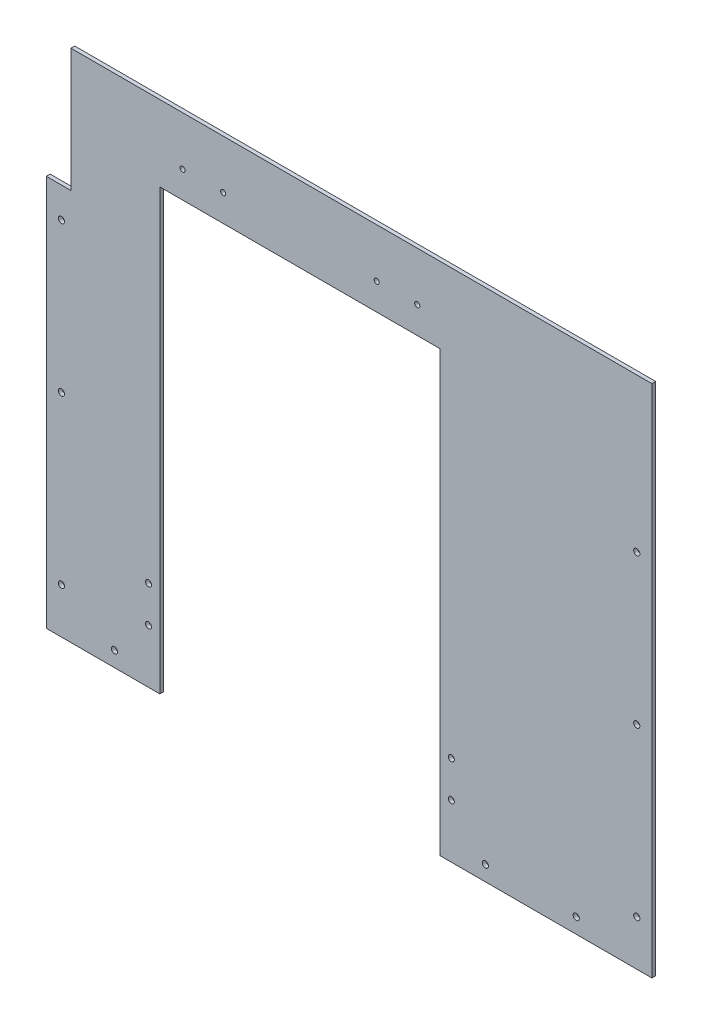
from build123d import *

# Parameters (mm, degrees)
SKETCH1_W           = 508
SKETCH1_H           = 508
BOSS_EXTRUDE1_DEPTH = 3.175
SKETCH2_R           = 2.54
SKETCH2_W           = 234.95
SKETCH2_H           = 368.3
CUT_EXTRUDE1_DEPTH  = 44.45
SKETCH4_R           = 2.159
CUT_EXTRUDE3_DEPTH  = 719.427505476
SKETCH5_R           = 2.6
CUT_EXTRUDE4_DEPTH  = 719.427505476
SKETCH6_W           = 487.3625
SKETCH6_H           = 76.2
CUT_EXTRUDE5_DEPTH  = 719.427505476


with BuildPart() as part:
    # Sketch1 → Boss-Extrude1 (new body)
    with BuildSketch(Plane.XY):
        with Locations((254, 254)):
            Rectangle(SKETCH1_W, SKETCH1_H)
    extrude(amount=BOSS_EXTRUDE1_DEPTH)

    # Sketch2 → Cut-Extrude1 (cut)
    with BuildSketch(Plane(origin=(0, 0, 0), x_dir=(-1, 0, 0), z_dir=(0, 0, -1))):
        with Locations((-339.725, 45.085)):
            Circle(SKETCH2_R)
        with Locations((-85.725, 45.085)):
            Circle(SKETCH2_R)
        with Locations((-339.725, 75.565)):
            Circle(SKETCH2_R)
        with Locations((-85.725, 75.565)):
            Circle(SKETCH2_R)
        with Locations((-212.725, 184.15)):
            Rectangle(SKETCH2_W, SKETCH2_H)
        Polygon((0, 403.06625), (0, 328.45375), (-20.6375, 328.45375), (-20.6375, 403.06625), (-20.6375, 508), (0, 508), align=None)
    extrude(amount=-CUT_EXTRUDE1_DEPTH, mode=Mode.SUBTRACT)

    # Sketch4 → Cut-Extrude3 (cut, through all)
    with BuildSketch(Plane(origin=(0, 0, 0), x_dir=(-1, 0, 0), z_dir=(0, 0, -1))):
        with Locations((-311.1754, 390.779)):
            Circle(SKETCH4_R)
        with Locations((-277.1394, 390.779)):
            Circle(SKETCH4_R)
        with Locations((-148.3614, 390.779)):
            Circle(SKETCH4_R)
        with Locations((-114.3254, 390.779)):
            Circle(SKETCH4_R)
    extrude(amount=-CUT_EXTRUDE3_DEPTH, mode=Mode.SUBTRACT)

    # Sketch5 → Cut-Extrude4 (cut, through all)
    with BuildSketch(Plane.XY.offset(3.175)):
        with Locations((12.7, 303.05375)):
            Circle(SKETCH5_R)
        with Locations((12.7, 177.8)):
            Circle(SKETCH5_R)
        with Locations((12.7, 38.1)):
            Circle(SKETCH5_R)
        with Locations((495.3, 38.1)):
            Circle(SKETCH5_R)
        with Locations((495.3, 177.8)):
            Circle(SKETCH5_R)
        with Locations((495.3, 303.05375)):
            Circle(SKETCH5_R)
        with Locations((495.3, 469.9)):
            Circle(SKETCH5_R)
        with Locations((57.15, 12.7)):
            Circle(SKETCH5_R)
        with Locations((368.3, 12.7)):
            Circle(SKETCH5_R)
        with Locations((444.5, 12.7)):
            Circle(SKETCH5_R)
        with Locations((33.3375, 495.3)):
            Circle(SKETCH5_R)
        with Locations((469.9, 495.3)):
            Circle(SKETCH5_R)
    extrude(amount=-CUT_EXTRUDE4_DEPTH, mode=Mode.SUBTRACT)

    # Sketch6 → Cut-Extrude5 (cut, through all)
    with BuildSketch(Plane.XY.offset(3.175)):
        with Locations((264.31875, 469.9)):
            Rectangle(SKETCH6_W, SKETCH6_H)
    extrude(amount=-CUT_EXTRUDE5_DEPTH, mode=Mode.SUBTRACT)


solid = part.part
